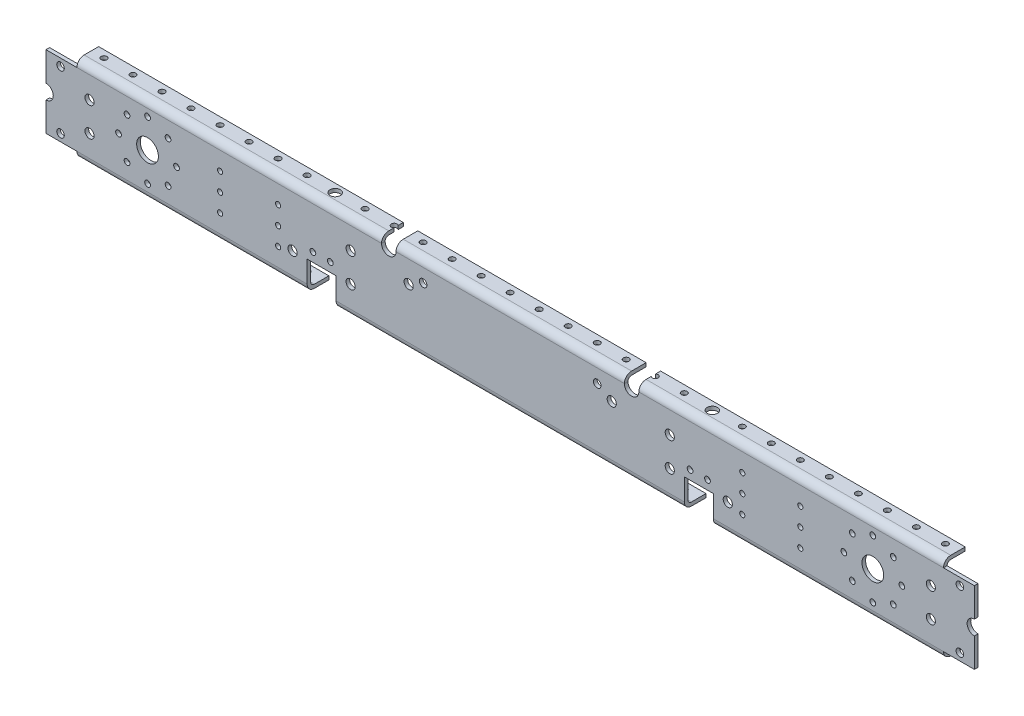
from build123d import *

# Parameters (mm, degrees)
SKETCH1_W                      = 758.698
SKETCH1_H                      = 76.2
BOSS_EXTRUDE1_DEPTH            = 3.175
CUT_EXTRUDE1_DEPTH             = 790.441582149
SKETCH3_W                      = 266.7
SKETCH3_H                      = 3.175
BOSS_EXTRUDE2_DEPTH            = 15.875
CUT_EXTRUDE2_DEPTH             = 790.594799011
SKETCH5_W                      = 266.7
SKETCH5_H                      = 3.175
BOSS_EXTRUDE3_DEPTH            = 15.875
SKETCH6_W                      = 557.149
SKETCH6_H                      = 25.4
CUT_EXTRUDE3_DEPTH             = 790.594799011
SKETCH7_W                      = 201.549
SKETCH7_H                      = 3.175
BOSS_EXTRUDE4_DEPTH            = 15.875
SKETCH8_W                      = 201.549
SKETCH8_H                      = 3.175
BOSS_EXTRUDE5_DEPTH            = 25.4
SKETCH9_W                      = 201.549
SKETCH9_H                      = 3.175
BOSS_EXTRUDE6_DEPTH            = 15.875
SKETCH10_W                     = 199.898
SKETCH10_H                     = 3.175
BOSS_EXTRUDE7_DEPTH            = 15.875
SKETCH11_W                     = 304.8
SKETCH11_H                     = 3.175
BOSS_EXTRUDE8_DEPTH            = 25.4
SKETCH12_W                     = 304.8
SKETCH12_H                     = 3.175
BOSS_EXTRUDE9_DEPTH            = 15.875
SKETCH13_W                     = 3.175
SKETCH13_H                     = 63.5
BOSS_EXTRUDE10_DEPTH           = 27.051
SKETCH14_W                     = 3.175
SKETCH14_H                     = 63.5
BOSS_EXTRUDE11_DEPTH           = 27.051
M18_CLEARANCE_HOLE1_D          = 19.05
M18_CLEARANCE_HOLE1_DEPTH      = 19.05
F_5_0_5_DIAMETER_HOLE1_D       = 5
F_5_0_5_DIAMETER_HOLE1_DEPTH   = 19.05
M4_CLEARANCE_HOLE1_D           = 4.4958
M4_CLEARANCE_HOLE1_DEPTH       = 19.05
F_6_6_6_6_DIAMETER_HOLE1_D     = 6.6
F_6_6_6_6_DIAMETER_HOLE1_DEPTH = 19.05
F_8_0_8_DIAMETER_HOLE1_D       = 8
F_8_0_8_DIAMETER_HOLE1_DEPTH   = 19.05
HOLE1_D                        = 12.7
F_5_0_5_DIAMETER_HOLE2_D       = 5
F_5_0_5_DIAMETER_HOLE2_DEPTH   = 3.175
F_5_0_5_DIAMETER_HOLE3_D       = 5
F_9_0_9_DIAMETER_HOLE1_D       = 9
F_9_0_9_DIAMETER_HOLE1_DEPTH   = 76.2
F_5_0_5_DIAMETER_HOLE4_D       = 5
F_5_0_5_DIAMETER_HOLE4_DEPTH   = 76.2
FILLET1_R                      = 3.175
FILLET2_R                      = 6.35


with BuildPart() as part:
    # Sketch1 → Boss-Extrude1 (new body)
    with BuildSketch(Plane(origin=(0, 0, -3.175), x_dir=(-1, 0, 0), z_dir=(0, 0, -1))):
        with Locations((-406.4, -38.1)):
            Rectangle(SKETCH1_W, SKETCH1_H)
    extrude(amount=-BOSS_EXTRUDE1_DEPTH)

    # Sketch2 → Cut-Extrude1 (cut, through all)
    with BuildSketch(Plane(origin=(0, 0, -3.175), x_dir=(-1, 0, 0), z_dir=(0, 0, -1))):
        with BuildLine():
            Line((-506.349, 0), (-519.049, 0))
            Line((-519.049, 0), (-519.049, -6.35))
            ThreePointArc((-519.049, -6.35), (-512.699, -12.7), (-506.349, -6.35))
            Line((-506.349, -6.35), (-506.349, 0))
        make_face()
    extrude(amount=-CUT_EXTRUDE1_DEPTH, mode=Mode.SUBTRACT)

    # Sketch3 → Boss-Extrude2 (add)
    with BuildSketch(Plane(origin=(0, 0, -3.175), x_dir=(-1, 0, 0), z_dir=(0, 0, -1))):
        with Locations((-652.399, -1.5875)):
            Rectangle(SKETCH3_W, SKETCH3_H)
    extrude(amount=BOSS_EXTRUDE2_DEPTH)

    # Sketch4 → Cut-Extrude2 (cut, through all)
    with BuildSketch(Plane(origin=(0, 0, -3.175), x_dir=(-1, 0, 0), z_dir=(0, 0, -1))):
        with BuildLine():
            Line((-293.751, 0), (-306.451, 0))
            Line((-306.451, 0), (-306.451, -6.35))
            ThreePointArc((-306.451, -6.35), (-300.101, -12.7), (-293.751, -6.35))
            Line((-293.751, -6.35), (-293.751, 0))
        make_face()
    extrude(amount=-CUT_EXTRUDE2_DEPTH, mode=Mode.SUBTRACT)

    # Sketch5 → Boss-Extrude3 (add)
    with BuildSketch(Plane(origin=(0, 0, -3.175), x_dir=(-1, 0, 0), z_dir=(0, 0, -1))):
        with Locations((-160.401, -1.5875)):
            Rectangle(SKETCH5_W, SKETCH5_H)
    extrude(amount=BOSS_EXTRUDE3_DEPTH)

    # Sketch6 → Cut-Extrude3 (cut, through all)
    with BuildSketch(Plane(origin=(0, 0, -3.175), x_dir=(-1, 0, 0), z_dir=(0, 0, -1))):
        with Locations((-507.1745, -63.5)):
            Rectangle(SKETCH6_W, SKETCH6_H)
    extrude(amount=-CUT_EXTRUDE3_DEPTH, mode=Mode.SUBTRACT)

    # Sketch7 → Boss-Extrude4 (add)
    with BuildSketch(Plane(origin=(0, 0, -3.175), x_dir=(-1, 0, 0), z_dir=(0, 0, -1))):
        with Locations((-127.8255, -74.6125)):
            Rectangle(SKETCH7_W, SKETCH7_H)
    extrude(amount=BOSS_EXTRUDE4_DEPTH)

    # Sketch8 → Boss-Extrude5 (add)
    with BuildSketch(Plane.XZ.offset(50.8)):
        with Locations((684.9745, -1.5875)):
            Rectangle(SKETCH8_W, SKETCH8_H)
    extrude(amount=BOSS_EXTRUDE5_DEPTH)

    # Sketch9 → Boss-Extrude6 (add)
    with BuildSketch(Plane(origin=(0, 0, -3.175), x_dir=(-1, 0, 0), z_dir=(0, 0, -1))):
        with Locations((-684.9745, -74.6125)):
            Rectangle(SKETCH9_W, SKETCH9_H)
    extrude(amount=BOSS_EXTRUDE6_DEPTH)

    # Sketch10 → Boss-Extrude7 (add)
    with BuildSketch(Plane(origin=(0, 0, -3.175), x_dir=(-1, 0, 0), z_dir=(0, 0, -1))):
        with Locations((-406.4, -1.5875)):
            Rectangle(SKETCH10_W, SKETCH10_H)
    extrude(amount=BOSS_EXTRUDE7_DEPTH)

    # Sketch11 → Boss-Extrude8 (add)
    with BuildSketch(Plane.XZ.offset(50.8)):
        with Locations((406.4, -1.5875)):
            Rectangle(SKETCH11_W, SKETCH11_H)
    extrude(amount=BOSS_EXTRUDE8_DEPTH)

    # Sketch12 → Boss-Extrude9 (add)
    with BuildSketch(Plane(origin=(0, 0, -3.175), x_dir=(-1, 0, 0), z_dir=(0, 0, -1))):
        with Locations((-406.4, -74.6125)):
            Rectangle(SKETCH12_W, SKETCH12_H)
    extrude(amount=BOSS_EXTRUDE9_DEPTH)

    # Sketch13 → Boss-Extrude10 (add)
    with BuildSketch(Plane(origin=(785.749, 0, 0), x_dir=(0, 0, -1), z_dir=(1, 0, 0))):
        with Locations((1.5875, -38.1)):
            Rectangle(SKETCH13_W, SKETCH13_H)
    extrude(amount=BOSS_EXTRUDE10_DEPTH)

    # Sketch14 → Boss-Extrude11 (add)
    with BuildSketch(Plane.ZY.offset(-27.051)):
        with Locations((-1.5875, -38.1)):
            Rectangle(SKETCH14_W, SKETCH14_H)
    extrude(amount=BOSS_EXTRUDE11_DEPTH)

    # M18 Clearance Hole1
    with Locations(Plane.XY):
        with Locations((723.9, -38.1), (88.9, -38.1)):
            Hole(M18_CLEARANCE_HOLE1_D / 2, depth=M18_CLEARANCE_HOLE1_DEPTH)

    # Ø5.0 (5) Diameter Hole1
    with Locations(Plane.XY):
        with Locations((233.68, -42.8625), (248.92, -42.8625), (698.5, -38.1), (749.3, -38.1), (741.860512242, -56.060512242), (705.939487758, -20.139487758), (705.939487758, -56.060512242), (741.860512242, -20.139487758), (723.9, -63.5), (723.9, -12.7), (114.3, -38.1), (63.5, -38.1), (70.939487758, -56.060512242), (106.860512242, -20.139487758), (106.860512242, -56.060512242), (70.939487758, -20.139487758), (88.9, -63.5), (88.9, -12.7), (563.88, -42.8625), (579.12, -42.8625)):
            Hole(F_5_0_5_DIAMETER_HOLE1_D / 2, depth=F_5_0_5_DIAMETER_HOLE1_DEPTH)

    # M4 Clearance Hole1
    with Locations(Plane.XY):
        with Locations((152.4, -38.1), (203.2, -38.1), (152.4, -22.225), (152.4, -53.975), (203.2, -53.975), (203.2, -22.225), (609.6, -22.225), (609.6, -53.975), (660.4, -53.975), (660.4, -22.225), (609.6, -38.1), (660.4, -38.1)):
            Hole(M4_CLEARANCE_HOLE1_D / 2, depth=M4_CLEARANCE_HOLE1_DEPTH)

    # Ø6.6 (6.6) Diameter Hole1
    with Locations(Plane.XY):
        with Locations((800.1, -63.5), (482.6, -18.218319194), (800.1, -12.7), (12.7, -63.5), (330.2, -18.218319194), (12.7, -12.7)):
            Hole(F_6_6_6_6_DIAMETER_HOLE1_D / 2, depth=F_6_6_6_6_DIAMETER_HOLE1_DEPTH)

    # Ø8.0 (8) Diameter Hole1
    with Locations(Plane.XY):
        with Locations((596.9, -50.8), (317.5, -25.4), (38.1, -25.4), (215.9, -50.8), (495.3, -25.4), (774.7, -50.8), (546.1, -50.8), (266.7, -25.4), (38.1, -50.8), (266.7, -50.8), (546.1, -25.4), (774.7, -25.4)):
            Hole(F_8_0_8_DIAMETER_HOLE1_D / 2, depth=F_8_0_8_DIAMETER_HOLE1_DEPTH)

    # Hole1 (through all)
    with Locations(Plane(origin=(0, 0, -3.175), x_dir=(-1, 0, 0), z_dir=(0, 0, -1))):
        with Locations((-812.8, -38.1), (0, -38.1)):
            Hole(HOLE1_D / 2)

    # Ø5.0 (5) Diameter Hole2
    with Locations(Plane(origin=(0, -76.2, 0), x_dir=(-1, 0, 0), z_dir=(0, -1, 0))):
        with Locations((-165.1, 12.7), (-63.5, 12.7), (-88.9, 12.7), (-190.5, 12.7), (-139.7, 12.7), (-38.1, 12.7), (-114.3, 12.7), (-215.9, 12.7), (-495.3, 12.7), (-393.7, 12.7), (-292.1, 12.7), (-317.5, 12.7), (-419.1, 12.7), (-520.7, 12.7), (-469.9, 12.7), (-368.3, 12.7), (-266.7, 12.7), (-342.9, 12.7), (-444.5, 12.7), (-546.1, 12.7), (-723.9, 12.7), (-622.3, 12.7), (-647.7, 12.7), (-749.3, 12.7), (-698.5, 12.7), (-596.9, 12.7), (-673.1, 12.7), (-774.7, 12.7)):
            Hole(F_5_0_5_DIAMETER_HOLE2_D / 2, depth=F_5_0_5_DIAMETER_HOLE2_DEPTH)

    # Ø5.0 (5) Diameter Hole3 (through all)
    with Locations(Plane(origin=(0, -3.175, 0), x_dir=(-1, 0, 0), z_dir=(0, -1, 0))):
        with Locations((-774.7, 12.7), (-673.1, 12.7), (-546.1, 12.7), (-596.9, 12.7), (-698.5, 12.7), (-749.3, 12.7), (-647.7, 12.7), (-622.3, 12.7), (-723.9, 12.7), (-495.3, 12.7), (-393.7, 12.7), (-317.5, 12.7), (-419.1, 12.7), (-469.9, 12.7), (-368.3, 12.7), (-342.9, 12.7), (-444.5, 12.7), (-292.1, 12.7), (-215.9, 12.7), (-114.3, 12.7), (-38.1, 12.7), (-139.7, 12.7), (-266.7, 12.7), (-190.5, 12.7), (-88.9, 12.7), (-63.5, 12.7), (-165.1, 12.7)):
            Hole(F_5_0_5_DIAMETER_HOLE3_D / 2)

    # Ø9.0 (9) Diameter Hole1
    with Locations(Plane(origin=(0, 0, 0), x_dir=(1, 0, 0), z_dir=(0, 1, 0))):
        with Locations((571.5, 11.868319194), (241.3, 11.868319194)):
            Hole(F_9_0_9_DIAMETER_HOLE1_D / 2, depth=F_9_0_9_DIAMETER_HOLE1_DEPTH)

    # Ø5.0 (5) Diameter Hole4
    with Locations(Plane(origin=(0, 0, 0), x_dir=(1, 0, 0), z_dir=(0, 1, 0))):
        with Locations((520.7, 12.7)):
            Hole(F_5_0_5_DIAMETER_HOLE4_D / 2, depth=F_5_0_5_DIAMETER_HOLE4_DEPTH)

    # Fillet1
    fillet1_edges = [part.edges().sort_by_distance(p)[0] for p in [
        (127.8255, -73.025, -3.175),
        (160.401, -3.175, -3.175),
        (406.4, -3.175, -3.175),
        (406.4, -73.025, -3.175),
        (652.399, -3.175, -3.175),
        (684.9745, -73.025, -3.175),
    ]]
    fillet(fillet1_edges, radius=FILLET1_R)

    # Fillet2
    fillet2_edges = [part.edges().sort_by_distance(p)[0] for p in [
        (652.399, 0, 0),
        (160.401, 0, 0),
        (406.4, 0, 0),
        (127.8255, -76.2, 0),
        (684.9745, -76.2, 0),
        (406.4, -76.2, 0),
    ]]
    fillet(fillet2_edges, radius=FILLET2_R)


solid = part.part
